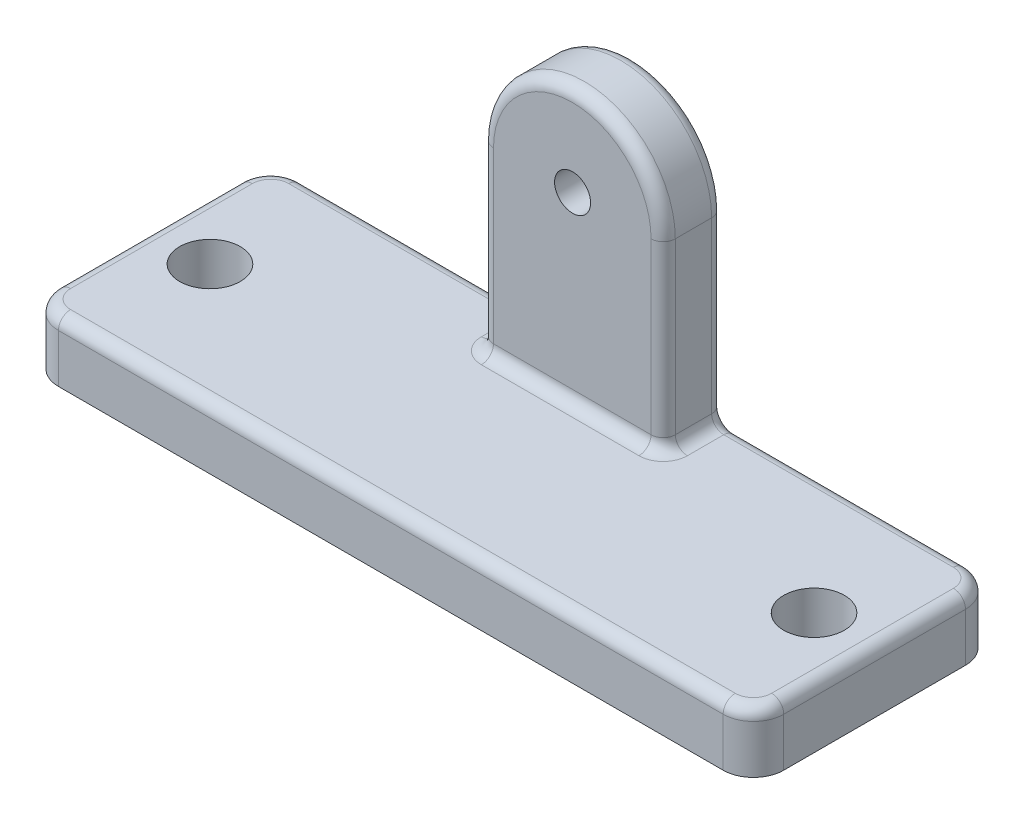
from build123d import *

# Parameters (mm, degrees)
CROQUIS2_R                 = 12.7
SALIENTE_EXTRUIR1_DEPTH    = 25.4
CORTAR_EXTRUIR1_DEPTH      = 185.585264851
CORTAR_EXTRUIR1_DEPTH_BACK = 76.2
CROQUIS7_W                 = 76.2
CROQUIS7_H                 = 12.7
SALIENTE_EXTRUIR2_DEPTH    = 25.4
REDONDEO1_R                = 5.08


with BuildPart() as part:
    # Croquis2 → Saliente-Extruir1 (new body)
    with BuildSketch(Plane(origin=(0, 0, 0), x_dir=(1, 0, 0), z_dir=(0, 1, 0))):
        with BuildLine():
            Line((139.3, -50.8), (-139.3, -50.8))
            ThreePointArc((-139.3, -50.8), (-148.280256121, -47.080256121), (-152, -38.1))
            Line((-152, -38.1), (-152, 38.1))
            ThreePointArc((-152, 38.1), (-148.280256121, 47.080256121), (-139.3, 50.8))
            Line((-139.3, 50.8), (139.3, 50.8))
            ThreePointArc((139.3, 50.8), (148.280256121, 47.080256121), (152, 38.1))
            Line((152, 38.1), (152, -38.1))
            ThreePointArc((152, -38.1), (148.280256121, -47.080256121), (139.3, -50.8))
        make_face()
        with Locations(Location((-126.6, 0, 0), (0, 0, 270))):
            Circle(CROQUIS2_R, mode=Mode.SUBTRACT)
        with Locations(Location((126.6, 0, 0), (0, 0, 270))):
            Circle(CROQUIS2_R, mode=Mode.SUBTRACT)
    extrude(amount=SALIENTE_EXTRUIR1_DEPTH)

    # Croquis7 → Cortar-Extruir1 (cut, two sides: drawn at the far end of the back side and taken through both)
    with BuildSketch(Plane(origin=(0, 0, -50.8), x_dir=(-1, 0, 0), z_dir=(0, 0, -1)).offset(-CORTAR_EXTRUIR1_DEPTH_BACK)):
        with Locations((0, 6.35)):
            Rectangle(CROQUIS7_W, CROQUIS7_H)
    extrude(amount=CORTAR_EXTRUIR1_DEPTH + CORTAR_EXTRUIR1_DEPTH_BACK, mode=Mode.SUBTRACT)

    # Croquis9 → Saliente-Extruir2 (add)
    with BuildSketch(Plane(origin=(0, 0, -50.8), x_dir=(-1, 0, 0), z_dir=(0, 0, -1))):
        with BuildLine():
            Line((-37.968696545, 101.6), (-37.968696545, 25.4))
            Line((-37.968696545, 25.4), (38.231303455, 25.4))
            Line((38.231303455, 25.4), (38.231303455, 101.6))
            ThreePointArc((38.231303455, 101.6), (0.131303455, 139.7), (-37.968696545, 101.6))
        make_face()
    extrude(amount=-SALIENTE_EXTRUIR2_DEPTH)

    # Croquis11 → Refrentado para tornillo con cabeza troncocónica de 9/162 (revolve, cut)
    with BuildSketch(Plane(origin=(0, 101.965288162, -50.8), x_dir=(0, 1, 0), z_dir=(1, 0, 0))):
        Polygon((0, 0), (0, 101.6), (7.53999, 101.6), (7.53999, 9.9314), (13.69187, 9.9314), (13.69187, 0.635), (14.32687, 0), align=None)
    revolve(axis=Axis((0, 101.965288162, -57.15), (0, 0, 1)), mode=Mode.SUBTRACT)

    # Redondeo1
    redondeo1_edges = [part.edges().sort_by_distance(p)[0] for p in [
        (148.280256121, 25.4, -47.080256121),
        (88.634348272, 25.4, -50.8),
        (-148.280256121, 25.4, -47.080256121),
        (-152, 25.4, 0),
        (-148.280256121, 25.4, 47.080256121),
        (0, 25.4, 50.8),
        (-88.765651728, 25.4, -50.8),
        (-38.231303455, 63.5, -25.4),
        (-0.131303455, 25.4, -25.4),
        (-38.231303455, 25.4, -38.1),
        (37.968696545, 63.5, -25.4),
        (37.968696545, 25.4, -38.1),
        (-0.131303455, 139.7, -25.4),
        (-38.231303455, 63.5, -50.8),
        (-0.131303455, 139.7, -50.8),
        (37.968696545, 63.5, -50.8),
        (148.280256121, 25.4, 47.080256121),
        (152, 25.4, 0),
    ]]
    fillet(redondeo1_edges, radius=REDONDEO1_R)


solid = part.part
